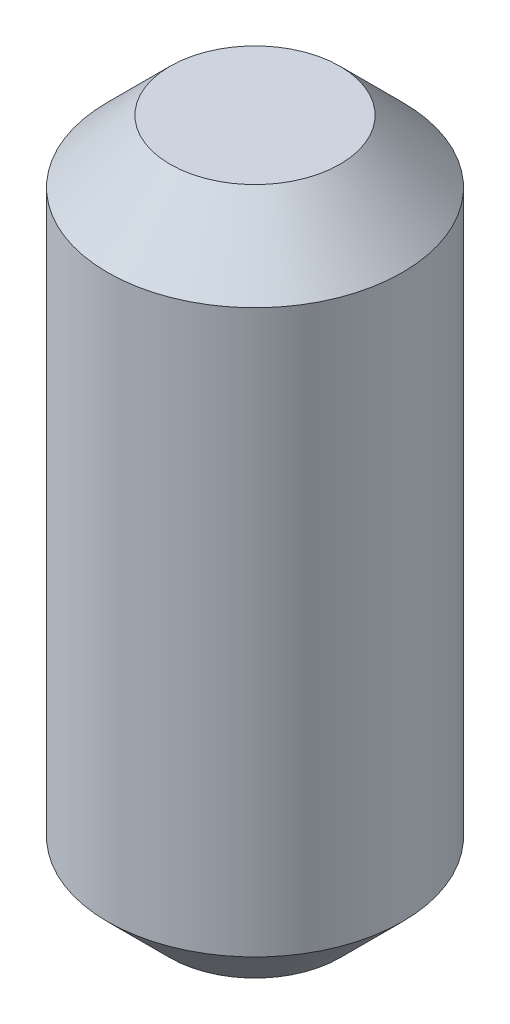
from build123d import *

# Parameters (mm, degrees)
SKETCH2_R           = 2.9972
BOSS_EXTRUDE1_DEPTH = 13.97
CHAMFER1_SIZE       = 1.27


with BuildPart() as part:
    # Sketch2 → Boss-Extrude1 (new body)
    with BuildSketch(Plane(origin=(0, 0, 0), x_dir=(1, 0, 0), z_dir=(0, 1, 0))):
        with Locations(Location((0, 0, 0), (0, 0, 270))):
            Circle(SKETCH2_R)
    extrude(amount=BOSS_EXTRUDE1_DEPTH)

    # Chamfer1
    chamfer1_edges = [part.edges().sort_by_distance(p)[0] for p in [
        (0, 0, -2.9972),
        (0, 13.97, -2.9972),
    ]]
    chamfer(chamfer1_edges, length=CHAMFER1_SIZE)


solid = part.part
